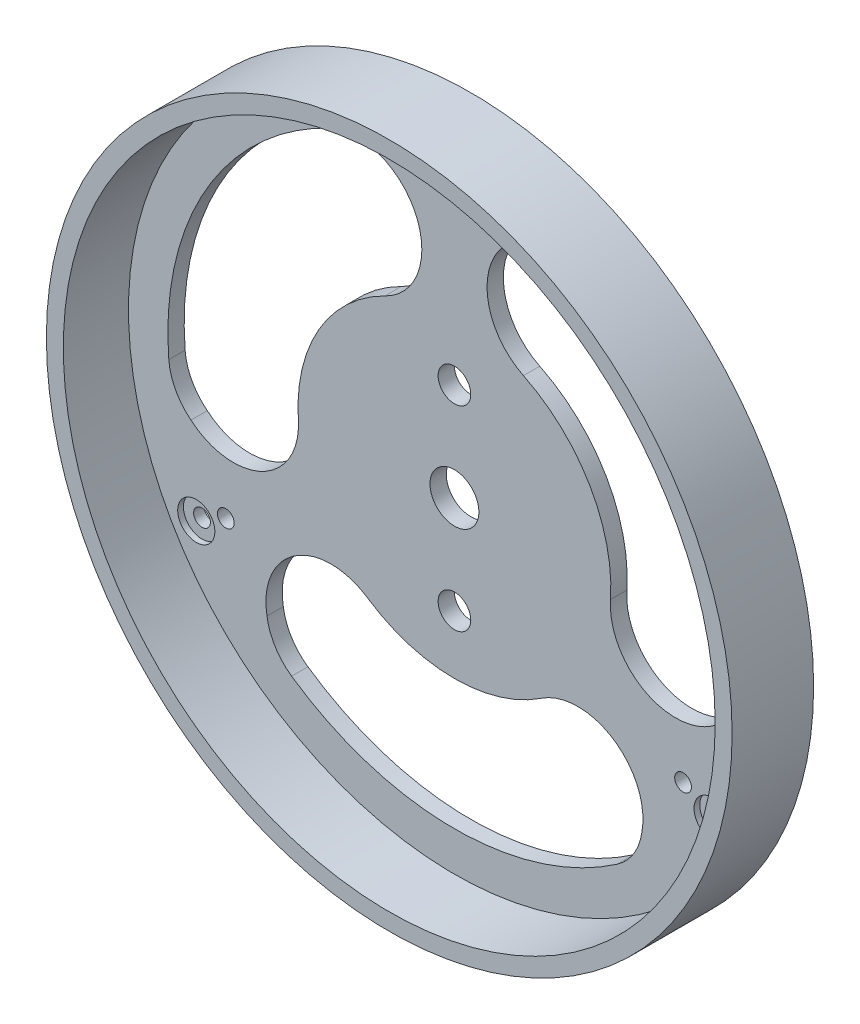
from build123d import *

# Parameters (mm, degrees)
SKETCH1_R                    = 66.8
SKETCH1_R_2                  = 63.5
BOSS_EXTRUDE1_DEPTH          = 15.88
SKETCH2_R                    = 63.5
BOSS_EXTRUDE2_DEPTH          = 3.18
CUT_EXTRUDE2_DEPTH           = 96.319305495
SKETCH5_R                    = 4.7625
SKETCH5_R_2                  = 3.18
CUT_EXTRUDE1_DEPTH           = 96.319305495
CIRPATTERN2_COUNT            = 3
CIRPATTERN3_COUNT            = 2
HOLE1_D                      = 3.2639
CIRPATTERN5_COUNT            = 3
CIRPATTERN5_ANGLE            = 240
HOLE2_D                      = 3.2639
CIRPATTERN6_COUNT            = 3
F_1_0_1_DIAMETER_HOLE1_D     = 7.239
F_1_0_1_DIAMETER_HOLE1_DEPTH = 1.1176
CIRPATTERN7_COUNT            = 3


with BuildPart() as part:
    # Sketch1 → Boss-Extrude1 (new body)
    with BuildSketch(Plane.XY):
        Circle(SKETCH1_R)
        Circle(SKETCH1_R_2, mode=Mode.SUBTRACT)
    extrude(amount=BOSS_EXTRUDE1_DEPTH)

    # Sketch2 → Boss-Extrude2 (add)
    with BuildSketch(Plane.XY):
        Circle(SKETCH2_R)
    extrude(amount=BOSS_EXTRUDE2_DEPTH)

    # Sketch6 → Cut-Extrude2 (cut, through all)
    with BuildSketch(Plane.XY.offset(3.18)):
        with BuildLine():
            ThreePointArc((-23.927369503, 50.442160591), (-48.348915265, 27.916177552), (-55.64814492, -4.496058651))
            ThreePointArc((-55.64814492, -4.496058651), (-54.328981929, -8.966343359), (-51.327740035, -12.532319168))
            ThreePointArc((-51.327740035, -12.532319168), (-37.384150369, -14.226795935), (-30.412116254, -2.033121978))
            ThreePointArc((-30.412116254, -2.033121978), (-26.421749263, 15.196103641), (-13.536182991, 27.309378426))
            ThreePointArc((-13.536182991, 27.309378426), (-6.368971607, 39.443915619), (-14.817446368, 50.723950466))
            ThreePointArc((-14.817446368, 50.723950466), (-19.40184977, 51.534874128), (-23.927369503, 50.442160591))
        make_face()
    cut_extrude2 = extrude(amount=-CUT_EXTRUDE2_DEPTH, mode=Mode.SUBTRACT)

    # Sketch5 → Cut-Extrude1 (cut, through all)
    with BuildSketch(Plane.XY.offset(3.18)):
        Circle(SKETCH5_R)
        with Locations((0, 19.05)):
            Circle(SKETCH5_R_2)
    cut_extrude1 = extrude(amount=-CUT_EXTRUDE1_DEPTH, mode=Mode.SUBTRACT)

    # CirPattern2: Cut-Extrude2 ×3 about axis
    cirpattern2_axis = Axis((0, 0, 0), (0, 0, 1))
    for i in range(1, CIRPATTERN2_COUNT):
        add(cut_extrude2.rotate(cirpattern2_axis, i * 360 / CIRPATTERN2_COUNT), mode=Mode.SUBTRACT)

    # CirPattern3: Cut-Extrude1 ×2 about axis
    cirpattern3_axis = Axis((0, 0, 0), (0, 0, 1))
    for i in range(1, CIRPATTERN3_COUNT):
        add(cut_extrude1.rotate(cirpattern3_axis, i * 360 / CIRPATTERN3_COUNT), mode=Mode.SUBTRACT)

    # Hole1 (through all)
    with Locations(Plane(origin=(0, 0, 0), x_dir=(-1, 0, 0), z_dir=(0, 0, -1))):
        with Locations((0, 58.07456)):
            hole1 = Hole(HOLE1_D / 2)

    # CirPattern5: Hole1 ×3 about axis
    cirpattern5_axis = Axis((0, 0, 0), (0, 0, 1))
    for i in range(1, CIRPATTERN5_COUNT):
        add(hole1.rotate(cirpattern5_axis, i * CIRPATTERN5_ANGLE / (CIRPATTERN5_COUNT - 1)), mode=Mode.SUBTRACT)

    # Hole2 (through all)
    with Locations(Plane(origin=(0, 0, 0), x_dir=(-1, 0, 0), z_dir=(0, 0, -1))):
        with Locations((0, 51.435)):
            hole2 = Hole(HOLE2_D / 2)

    # CirPattern6: Hole2 ×3 about axis
    cirpattern6_axis = Axis((0, 0, 0), (0, 0, 1))
    for i in range(1, CIRPATTERN6_COUNT):
        add(hole2.rotate(cirpattern6_axis, i * 360 / CIRPATTERN6_COUNT), mode=Mode.SUBTRACT)

    # Ø1.0 (1) Diameter Hole1
    with Locations(Plane(origin=(0, 58.07456, 3.18), x_dir=(1, 0, 0), z_dir=(0, 0, 1))):
        with Locations((0, 0)):
            f_1_0_1_diameter_hole1 = Hole(F_1_0_1_DIAMETER_HOLE1_D / 2, depth=F_1_0_1_DIAMETER_HOLE1_DEPTH)

    # CirPattern7: Ø1.0 (1) Diameter Hole1 ×3 about axis
    cirpattern7_axis = Axis((0, 0, 0), (0, 0, 1))
    for i in range(1, CIRPATTERN7_COUNT):
        add(f_1_0_1_diameter_hole1.rotate(cirpattern7_axis, i * 360 / CIRPATTERN7_COUNT), mode=Mode.SUBTRACT)


solid = part.part
